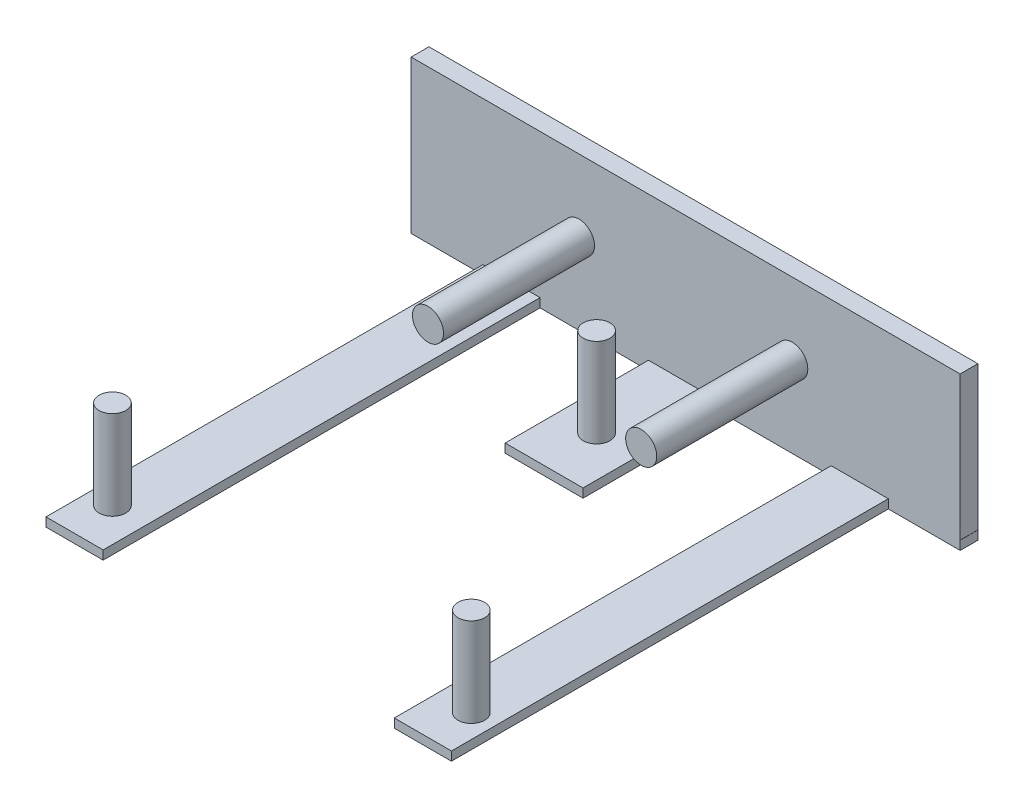
from build123d import *

# Parameters (mm, degrees)
BOSS_EXTRUDE1_START = 5.08
SKETCH1_R           = 4.445
BOSS_EXTRUDE1_DEPTH = 43.18
SKETCH2_W           = 156.929873994
SKETCH2_H           = 41.148
BOSS_EXTRUDE2_DEPTH = 5.08
SKETCH3_W           = 22.259444318
SKETCH3_H           = 46.05258329
BOSS_EXTRUDE3_DEPTH = 2.54
SKETCH4_W           = 16.338838854
SKETCH4_H           = 129.983858652
BOSS_EXTRUDE4_DEPTH = 2.54
SKETCH5_W           = 156.97130624
SKETCH5_H           = 5.08
BOSS_EXTRUDE5_DEPTH = 2.54
SKETCH6_R           = 3.81
BOSS_EXTRUDE6_DEPTH = 25.4
SKETCH8_R           = 3.81
BOSS_EXTRUDE7_DEPTH = 25.4


with BuildPart() as part:
    # Sketch1 → Boss-Extrude1 (new body)
    with BuildSketch(Plane.XY.offset(BOSS_EXTRUDE1_START)):
        with Locations((29.969120003, 8.382)):
            Circle(SKETCH1_R)
    extrude(amount=-BOSS_EXTRUDE1_DEPTH)


with BuildPart() as body_2:
    # Mirror2: mirrored copy
    add(part.part.mirror(Plane(origin=(-0.510879997, 0, 0), x_dir=(0, 0, 1), z_dir=(1, 0, 0))))


with BuildPart() as part_1:
    add(part.part)

    add(body_2.part)  # Boss-Extrude2 merges body 2
    # Sketch2 → Boss-Extrude2 (add)
    with BuildSketch(Plane(origin=(0, 0, -38.1), x_dir=(-1, 0, 0), z_dir=(0, 0, -1))):
        with Locations((0.510879997, 8.382)):
            Rectangle(SKETCH2_W, SKETCH2_H)
    extrude(amount=BOSS_EXTRUDE2_DEPTH)

    # Sketch3 → Boss-Extrude3 (add)
    with BuildSketch(Plane.XZ.offset(12.192)):
        with Locations((0, -20.153708355)):
            Rectangle(SKETCH3_W, SKETCH3_H)
    extrude(amount=BOSS_EXTRUDE3_DEPTH)

    # Sketch4 → Boss-Extrude4 (add)
    with BuildSketch(Plane(origin=(0, -12.192, 0), x_dir=(-1, 0, 0), z_dir=(0, -1, 0))):
        with Locations((50.295624604, -21.811929326)):
            Rectangle(SKETCH4_W, SKETCH4_H)
    boss_extrude4 = extrude(amount=BOSS_EXTRUDE4_DEPTH)

    # Mirror3: Boss-Extrude4 across plane
    add(boss_extrude4.mirror(Plane(origin=(-0.510879997, 0, 0), x_dir=(0, 0, 1), z_dir=(1, 0, 0))))

    # Sketch5 → Boss-Extrude5 (add)
    with BuildSketch(Plane.XZ.offset(12.192)):
        with Locations((-0.490163874, -40.64)):
            Rectangle(SKETCH5_W, SKETCH5_H)
    extrude(amount=BOSS_EXTRUDE5_DEPTH)

    # Sketch6 → Boss-Extrude6 (add)
    with BuildSketch(Plane(origin=(0, -12.192, 0), x_dir=(1, 0, 0), z_dir=(0, 1, 0))):
        with Locations(Location((-0.510879997, 12.643336172, 0), (0, 0, 270))):
            Circle(SKETCH6_R)
    extrude(amount=BOSS_EXTRUDE6_DEPTH)

    # Sketch8 → Boss-Extrude7 (add)
    with BuildSketch(Plane(origin=(0, -12.192, 0), x_dir=(1, 0, 0), z_dir=(0, 1, 0))):
        with Locations(Location((50.792572725, -74.463197468, 0), (0, 0, 90))):
            Circle(SKETCH8_R)
    boss_extrude7 = extrude(amount=BOSS_EXTRUDE7_DEPTH)

    # Mirror4: Boss-Extrude7 across plane
    add(boss_extrude7.mirror(Plane(origin=(-0.510879997, 0, 0), x_dir=(0, 0, 1), z_dir=(1, 0, 0))))


solid = part_1.part
